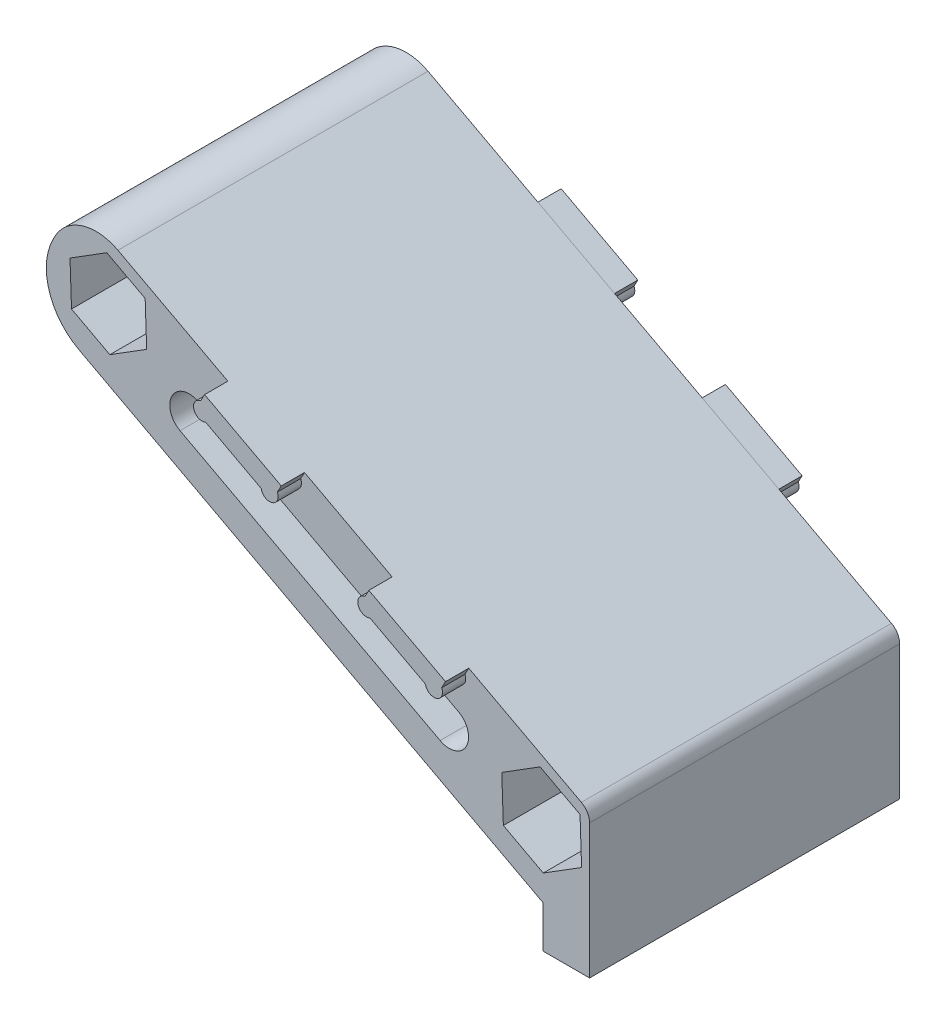
from build123d import *
from OCP.BRepFilletAPI import BRepFilletAPI_MakeFillet

# Parameters (mm, degrees)
BASE_SHAPE_DEPTH          = 20
EARS_DEPTH                = 1.5
EARS_2_DEPTH              = 1.5
GOPRO_BATTERY_STRAP_DEPTH = 20
CUT_EXTRUDE2_DEPTH        = 20
FILLET1_R1                = 3
FILLET1_R2                = 4


with BuildPart() as part:
    # Sketch1 → Base shape (new body)
    with BuildSketch(Plane.XY):
        with BuildLine():
            Line((0.153164223, 37.040707748), (33.603923048, 19.254623784))
            Line((33.603923048, 19.254623784), (33.603923048, 16.55))
            Line((33.603923048, 16.55), (36.603923048, 16.55))
            Line((36.603923048, 16.55), (36.603923048, 25.213139235))
            ThreePointArc((36.603923048, 25.213139235), (36.461090349, 25.72817731), (36.073394611, 26.096086828))
            Line((36.073394611, 26.096086828), (3.533359475, 43.397930417))
            Line((3.533359475, 43.397930417), (0.153164223, 37.040707748))
        make_face()
    extrude(amount=BASE_SHAPE_DEPTH)


with BuildPart() as body_2:
    # Sketch2 → Ears (new body)
    with BuildSketch(Plane(origin=(0, 0, 0), x_dir=(-1, 0, 0), z_dir=(0, 0, -1))):
        with BuildLine():
            ThreePointArc((-13.340223149, 36.71118744), (-12.581057932, 37.048498329), (-13.021812565, 37.752661532))
            Line((-13.021812565, 37.752661532), (-13.270593843, 38.220551065))
            Line((-13.270593843, 38.220551065), (-18.215100363, 35.591510313))
            Line((-18.215100363, 35.591510313), (-17.966319085, 35.12362078))
            ThreePointArc((-17.966319085, 35.12362078), (-17.629008197, 34.364455562), (-16.924844994, 34.805210196))
            Line((-16.924844994, 34.805210196), (-13.340223149, 36.71118744))
        make_face()
    ears = extrude(amount=EARS_DEPTH)


with BuildPart() as body_3:
    # Sketch2 → Ears 2 (new body)
    with BuildSketch(Plane(origin=(0, 0, 0), x_dir=(-1, 0, 0), z_dir=(0, 0, -1))):
        with BuildLine():
            Line((-23.61718368, 32.119002778), (-23.865964957, 32.586892311))
            Line((-23.865964957, 32.586892311), (-28.810471477, 29.95785156))
            Line((-28.810471477, 29.95785156), (-28.5616902, 29.489962027))
            ThreePointArc((-28.5616902, 29.489962027), (-28.224379311, 28.730796809), (-27.520216108, 29.171551443))
            Line((-27.520216108, 29.171551443), (-23.935594263, 31.077528687))
            ThreePointArc((-23.935594263, 31.077528687), (-23.176429046, 31.414839575), (-23.61718368, 32.119002778))
        make_face()
    ears_2 = extrude(amount=EARS_2_DEPTH)


with BuildPart() as part_1:
    add(part.part)

    # Ear mirror: Ears, Ears 2 across plane
    add(ears.mirror(Plane(origin=(0, 0, 10), x_dir=(1, 0, 0), z_dir=(0, 0, -1))))
    add(ears_2.mirror(Plane(origin=(0, 0, 10), x_dir=(1, 0, 0), z_dir=(0, 0, -1))))

    # Sketch3 → GoPro battery strap (cut)
    with BuildSketch(Plane(origin=(0, 0, 0), x_dir=(-1, 0, 0), z_dir=(0, 0, -1))):
        with BuildLine():
            Line((-26.963809088, 24.993746603), (-10.187804823, 33.913706296))
            ThreePointArc((-10.187804823, 33.913706296), (-9.670959786, 35.604230241), (-11.36148373, 36.121075278))
            Line((-11.36148373, 36.121075278), (-28.137487995, 27.201115585))
            ThreePointArc((-28.137487995, 27.201115585), (-28.654333032, 25.510591641), (-26.963809088, 24.993746603))
        make_face()
    extrude(amount=-GOPRO_BATTERY_STRAP_DEPTH, mode=Mode.SUBTRACT)

    # Sketch5 → Cut-Extrude2 (cut)
    with BuildSketch(Plane.XY.offset(20)):
        Polygon((30.93926782, 25.201726304), (31.041021451, 22.287883561), (33.615360104, 20.919083418), (36.087945127, 22.464126019), (35.986191496, 25.377968762), (33.411852843, 26.746768905), align=None)
        Polygon((5.465117061, 41.493054899), (3.090456198, 40.009202104), (3.188179982, 37.210759074), (5.660564629, 35.896168838), (8.035225493, 37.380021633), (7.937501709, 40.178464663), align=None)
    extrude(amount=-CUT_EXTRUDE2_DEPTH, mode=Mode.SUBTRACT)

    # Fillet1: one fillet with a radius per group of edges: ONE call of the kernel's fillet builder (fillet() takes one radius for all edges)
    fillet1_edges_1 = [part_1.edges().sort_by_distance(p)[0] for p in [
        (3.533359475, 43.397930417, 10),
    ]]
    fillet1_edges_2 = [part_1.edges().sort_by_distance(p)[0] for p in [
        (0.153164223, 37.040707748, 10),
    ]]
    fillet1 = BRepFilletAPI_MakeFillet(part_1.part.solid().wrapped)
    for e in fillet1_edges_1:
        fillet1.Add(FILLET1_R1, e.wrapped)
    for e in fillet1_edges_2:
        fillet1.Add(FILLET1_R2, e.wrapped)
    add(Compound.cast(fillet1.Shape()), mode=Mode.REPLACE)


solid = Compound([body_2.part, body_3.part, part_1.part])
